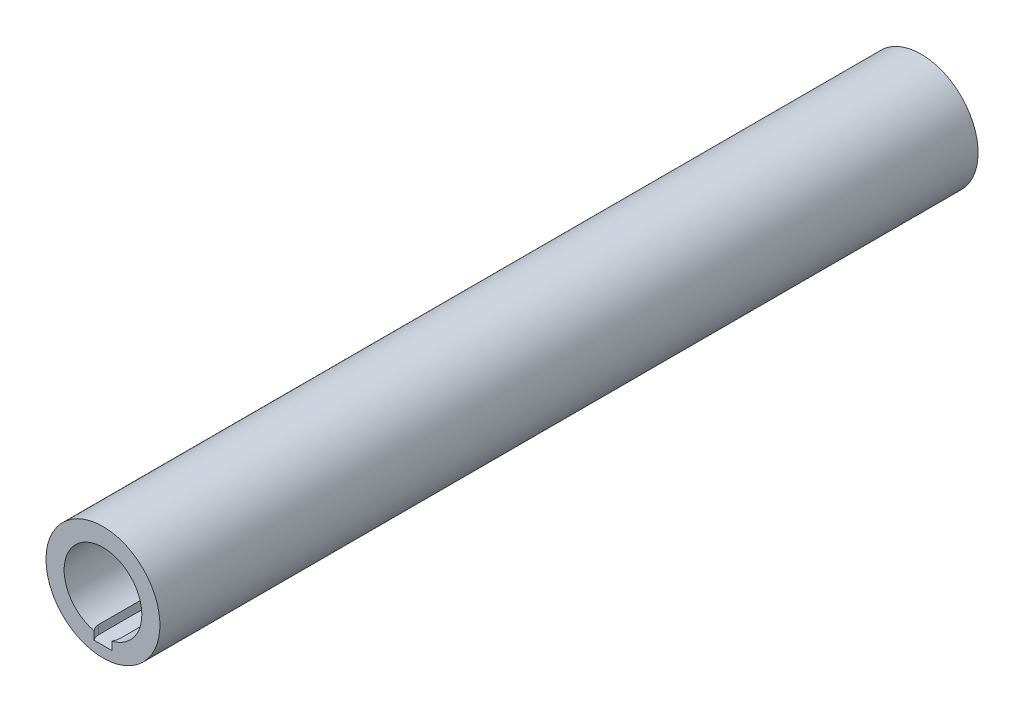
from build123d import *

# Parameters (mm, degrees)
CUT_EXTRUDE1_DEPTH      = 10
CUT_EXTRUDE1_DEPTH_BACK = 5


with BuildPart() as part:
    # Sketch1 → Revolve1 (revolve)
    with BuildSketch(Plane.XZ):
        Polygon((38.2, -516.518644329), (38.2, 57.999999671), (25.5, 57.999999671), (25.5, -12.000000329), (29, -12.000000329), (29, -22.000000329), (20.2, -22.000000329), (20.2, -436.518644329), (29, -436.518644329), (29, -446.518644329), (25.5, -446.518644329), (25.5, -516.518644329), align=None)
    revolve(axis=Axis((-1.8, 0, 70), (0, 0, -1)))

    # Sketch3 → Cut-Extrude1 (cut, two sides: drawn at the far end of the back side and taken through both)
    with BuildSketch(Plane(origin=(0, -27.3, 0), x_dir=(1, 0, 0), z_dir=(0, 1, 0)).offset(-CUT_EXTRUDE1_DEPTH_BACK)):
        with BuildLine():
            Line((6.2, 521.518644329), (6.2, 461.518644329))
            ThreePointArc((6.2, 461.518644329), (-1.8, 453.518644329), (-9.8, 461.518644329))
            Line((-9.8, 461.518644329), (-9.8, 521.518644329))
            ThreePointArc((-9.8, 521.518644329), (-1.8, 529.518644329), (6.2, 521.518644329))
        make_face()
        with BuildLine():
            Line((-9.8, -53.000000001), (-9.8, 6.999999999))
            ThreePointArc((-9.8, 6.999999999), (-1.8, 14.999999999), (6.2, 6.999999999))
            Line((6.2, 6.999999999), (6.2, -53.000000001))
            ThreePointArc((6.2, -53.000000001), (-1.8, -61.000000001), (-9.8, -53.000000001))
        make_face()
    extrude(amount=CUT_EXTRUDE1_DEPTH + CUT_EXTRUDE1_DEPTH_BACK, mode=Mode.SUBTRACT)


solid = part.part
